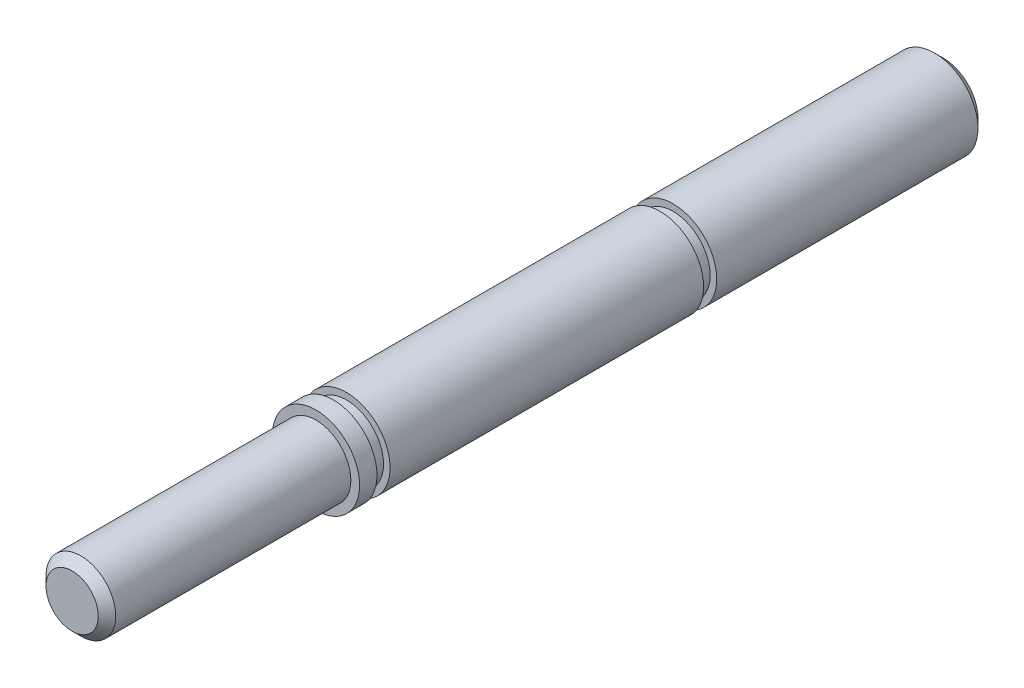
from build123d import *

# Parameters (mm, degrees)
CROQUIS1_R              = 5
SALIENTE_EXTRUIR1_DEPTH = 50
CHAFL_N1_SIZE           = 1
CROQUIS4_W              = 1.5
CROQUIS4_H              = 1.5
CROQUIS5_OUTSIDE_W      = 32.2
CROQUIS5_OUTSIDE_H      = 32.2
CROQUIS5_OUTSIDE_R      = 4
CORTAR_EXTRUIR2_DEPTH   = 28
CHAFL_N3_SIZE           = 1


with BuildPart() as part:
    # Croquis1 → Saliente-Extruir1 (new, symmetric)
    with BuildSketch(Plane.XY):
        Circle(CROQUIS1_R)
    extrude(amount=SALIENTE_EXTRUIR1_DEPTH, both=True)

    # Chaflán1
    chafl_n1_edges = [part.edges().sort_by_distance(p)[0] for p in [
        (-5, 0, -50),
    ]]
    chamfer(chafl_n1_edges, length=CHAFL_N1_SIZE)

    # Croquis4 → Cortar-Revolución2 (revolve, cut)
    with BuildSketch(Plane(origin=(0, 0, 0), x_dir=(1, 0, 0), z_dir=(0, 1, 0))):
        with Locations((5, 18.25)):
            Rectangle(CROQUIS4_W, CROQUIS4_H)
        with Locations((5, -19.25)):
            Rectangle(CROQUIS4_W, CROQUIS4_H)
    revolve(axis=Axis((0, 0, 0), (0, 0, -1)), mode=Mode.SUBTRACT)

    # Croquis5 outside → Cortar-Extruir2 (cut)
    with BuildSketch(Plane.XY.offset(50)):
        Rectangle(CROQUIS5_OUTSIDE_W, CROQUIS5_OUTSIDE_H)
        Circle(CROQUIS5_OUTSIDE_R, mode=Mode.SUBTRACT)
    extrude(amount=-CORTAR_EXTRUIR2_DEPTH, mode=Mode.SUBTRACT)

    # Chaflán3
    chafl_n3_edges = [part.edges().sort_by_distance(p)[0] for p in [
        (-4, 0, 50),
    ]]
    chamfer(chafl_n3_edges, length=CHAFL_N3_SIZE)


solid = part.part
